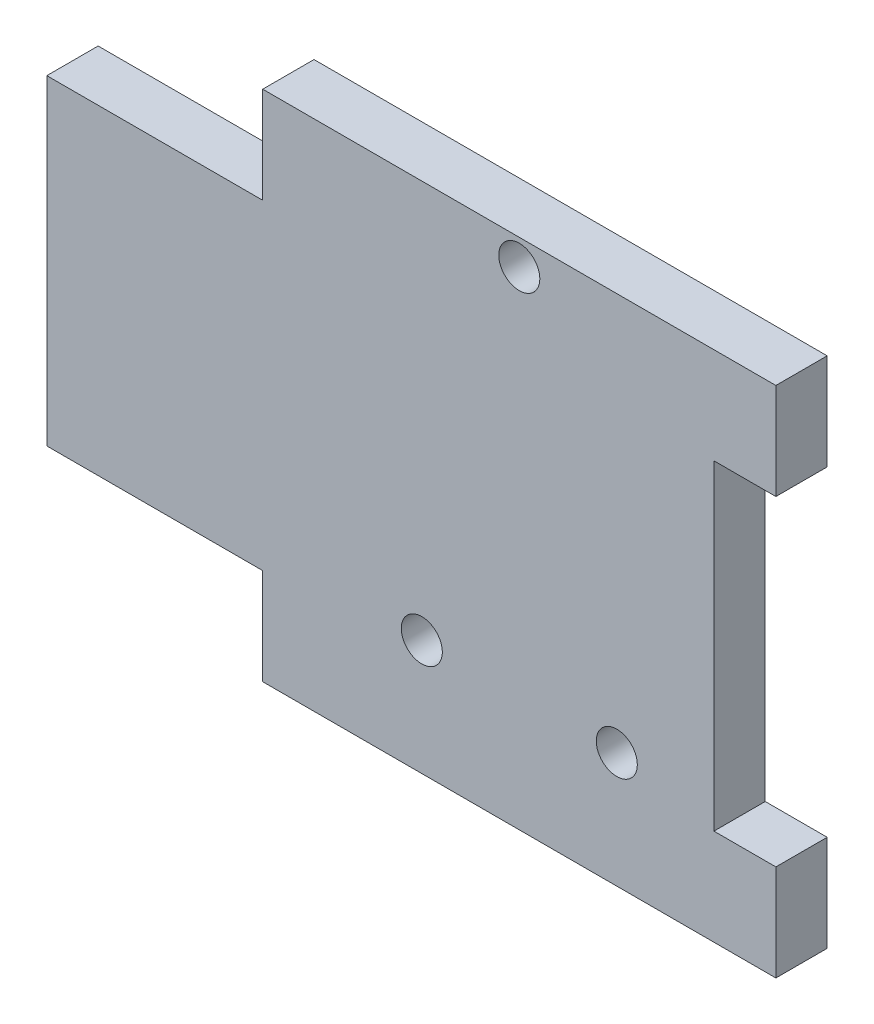
from build123d import *

# Parameters (mm, degrees)
SKETCH1_R           = 1.6
BOSS_EXTRUDE1_DEPTH = 4


with BuildPart() as part:
    # Sketch1 → Boss-Extrude1 (new body)
    with BuildSketch(Plane(origin=(0, 0, 0), x_dir=(-1, 0, 0), z_dir=(0, 0, 1))):
        Polygon((-20, 40), (20, 40), (20, 32.5), (36.828427125, 32.5), (36.828427125, 7.5), (20, 7.5), (20, 0), (-20, 0), (-20, 7.5), (-15.171572875, 7.5), (-15.171572875, 32.5), (-20, 32.5), align=None)
        with Locations(Location((-7.6, 31, 0), (0, 0, 180))):
            Circle(SKETCH1_R, mode=Mode.SUBTRACT)
        with Locations((7.6, 31)):
            Circle(SKETCH1_R, mode=Mode.SUBTRACT)
        with Locations(Location((0, 2, 0), (0, 0, 180))):
            Circle(SKETCH1_R, mode=Mode.SUBTRACT)
    extrude(amount=BOSS_EXTRUDE1_DEPTH)


solid = part.part
